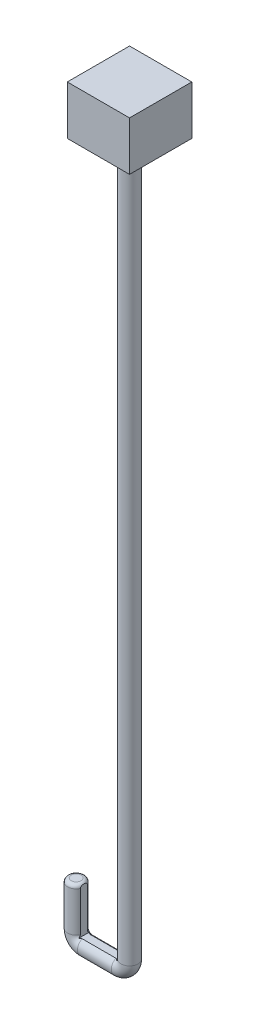
from build123d import *

# Parameters (mm, degrees)
CROQUIS1_W              = 70
CROQUIS1_H              = 55
SALIENTE_EXTRUIR1_DEPTH = 70
CROQUIS2_R              = 9.525
SALIENTE_EXTRUIR2_DEPTH = 10
CROQUIS3_R              = 9.525
REDONDEO1_R             = 4
CROQUIS5_W              = 42.976896334
CROQUIS5_H              = 90.412198776
CORTAR_EXTRUIR2_DEPTH   = 70


with BuildPart() as part:
    # Croquis1 → Saliente-Extruir1 (new body)
    with BuildSketch(Plane.XY):
        with Locations((35, -27.5)):
            Rectangle(CROQUIS1_W, CROQUIS1_H)
    extrude(amount=SALIENTE_EXTRUIR1_DEPTH)

    # Croquis2 → Saliente-Extruir2 (add)
    with BuildSketch(Plane.XZ.offset(55)):
        with Locations(Location((35, 35, 0), (0, 0, 90))):
            Circle(CROQUIS2_R)
    extrude(amount=SALIENTE_EXTRUIR2_DEPTH)

    # Barrer1: sweep along a curve in space
    with BuildLine() as barrer1_path:
        Line((35, -65, 35), (35, -854, 35))
        ThreePointArc((35, -854, 35), (31.778174593, -861.778174593, 35), (24, -865, 35))
        Line((24, -865, 35), (-14, -865, 35))
        ThreePointArc((-14, -865, 35), (-21.778174593, -861.778174593, 35), (-25, -854, 35))
        Line((-25, -854, 35), (-25, -805, 35))
    # Croquis3 → Barrer1 (sweep)
    with BuildSketch(Plane.XZ.offset(65)):
        with Locations((35, 35)):
            Circle(CROQUIS3_R)
    sweep(path=barrer1_path.line)

    # Redondeo1
    redondeo1_edges = [part.edges().sort_by_distance(p)[0] for p in [
        (-15.475, -805, 35),
    ]]
    fillet(redondeo1_edges, radius=REDONDEO1_R)

    # Croquis5 → Cortar-Extruir2 (cut)
    with BuildSketch(Plane.XY):
        with Locations((5.153209537, -811.315289476)):
            Rectangle(CROQUIS5_W, CROQUIS5_H)
    extrude(amount=CORTAR_EXTRUIR2_DEPTH, mode=Mode.SUBTRACT)


solid = part.part
